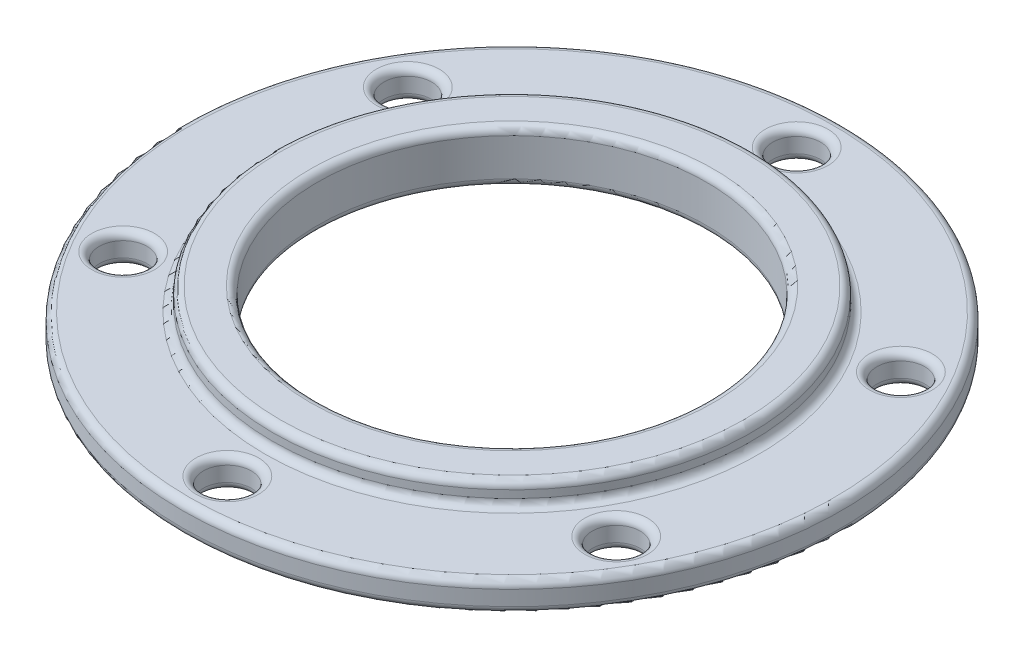
from build123d import *

# Parameters (mm, degrees)
SKETCH1_R           = 22.025
SKETCH1_R_2         = 1.6
SKETCH1_R_3         = 13
BOSS_EXTRUDE1_DEPTH = 2
BOSS_EXTRUDE2_START = 1.5
SKETCH2_R           = 16
SKETCH2_R_2         = 13
BOSS_EXTRUDE2_DEPTH = 1.5
FILLET1_R           = 0.5


with BuildPart() as part:
    # Sketch1 → Boss-Extrude1 (new body)
    with BuildSketch(Plane(origin=(0, 0, 0), x_dir=(1, 0, 0), z_dir=(0, 1, 0))):
        with Locations(Location((0, 0, 0), (0, 0, 270))):
            Circle(SKETCH1_R)
        with Locations(Location((0, 19.025, 0), (0, 0, 270))):
            Circle(SKETCH1_R_2, mode=Mode.SUBTRACT)
        with Locations(Location((16.476133307, 9.5125, 0), (0, 0, 270))):
            Circle(SKETCH1_R_2, mode=Mode.SUBTRACT)
        with Locations(Location((16.476133307, -9.5125, 0), (0, 0, 270))):
            Circle(SKETCH1_R_2, mode=Mode.SUBTRACT)
        with Locations(Location((0, -19.025, 0), (0, 0, 270))):
            Circle(SKETCH1_R_2, mode=Mode.SUBTRACT)
        with Locations(Location((-16.476133307, -9.5125, 0), (0, 0, 270))):
            Circle(SKETCH1_R_2, mode=Mode.SUBTRACT)
        with Locations(Location((-16.476133307, 9.5125, 0), (0, 0, 270))):
            Circle(SKETCH1_R_2, mode=Mode.SUBTRACT)
        with Locations(Location((0, 0, 0), (0, 0, 270))):
            Circle(SKETCH1_R_3, mode=Mode.SUBTRACT)
    extrude(amount=-BOSS_EXTRUDE1_DEPTH)

    # Sketch2 → Boss-Extrude2 (add)
    with BuildSketch(Plane(origin=(0, 0, 0), x_dir=(1, 0, 0), z_dir=(0, 1, 0)).offset(BOSS_EXTRUDE2_START)):
        with Locations(Location((0, 0, 0), (0, 0, 270))):
            Circle(SKETCH2_R)
        with Locations(Location((0, 0, 0), (0, 0, 270))):
            Circle(SKETCH2_R_2, mode=Mode.SUBTRACT)
    extrude(amount=-BOSS_EXTRUDE2_DEPTH)

    # Fillet1
    fillet1_edges = [part.edges().sort_by_distance(p)[0] for p in [
        (16.476133307, -2, -11.1125),
        (16.476133307, 0, -11.1125),
        (16.476133307, -2, 7.9125),
        (16.476133307, 0, 7.9125),
        (0, 0, -22.025),
        (0, -2, 17.425),
        (0, 0, 17.425),
        (-16.476133307, -2, 7.9125),
        (-16.476133307, 0, 7.9125),
        (-16.476133307, -2, -11.1125),
        (-16.476133307, 0, -11.1125),
        (0, 1.5, -16),
        (0, 0, -16),
        (0, 1.5, -13),
        (0, -2, -22.025),
        (0, -2, -20.625),
        (0, 0, -20.625),
        (0, -2, -13),
    ]]
    fillet(fillet1_edges, radius=FILLET1_R)


solid = part.part
